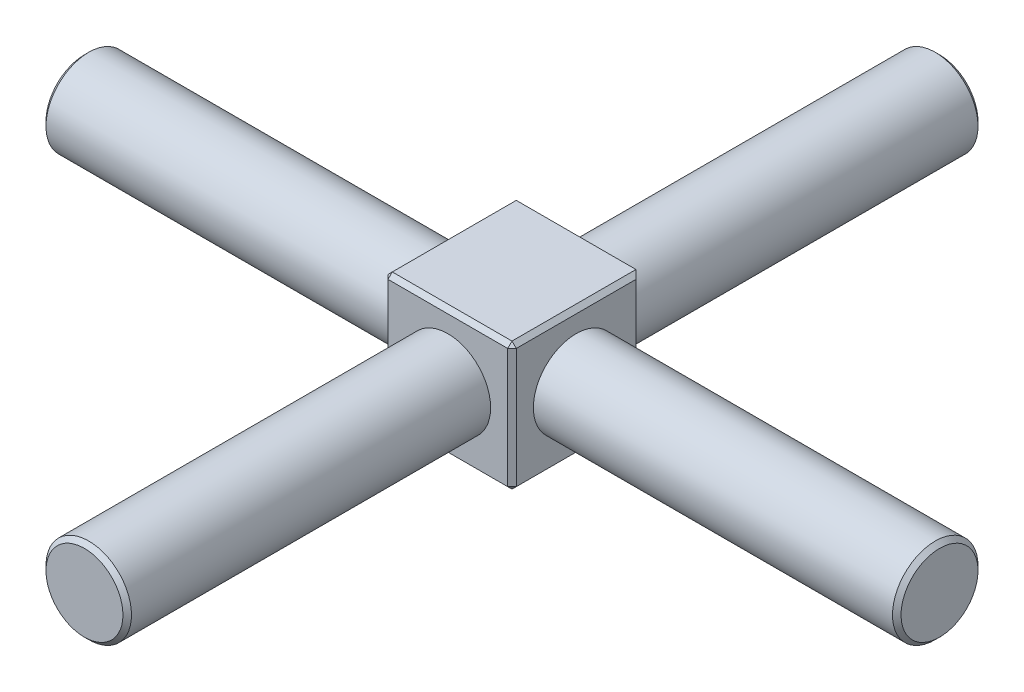
from build123d import *

# Parameters (mm, degrees)
SKETCH1_W           = 15
SKETCH1_H           = 15
BOSS_EXTRUDE1_DEPTH = 15
BOSS_EXTRUDE2_START = -7.5
SKETCH3_R           = 5
BOSS_EXTRUDE2_DEPTH = 50
BOSS_EXTRUDE3_START = -7.5
SKETCH4_R           = 5
BOSS_EXTRUDE3_DEPTH = 50
CHAMFER1_SIZE       = 0.5


with BuildPart() as part:
    # Sketch1 → Boss-Extrude1 (new body)
    with BuildSketch(Plane.XY):
        Rectangle(SKETCH1_W, SKETCH1_H)
    extrude(amount=BOSS_EXTRUDE1_DEPTH)

    # Sketch3 → Boss-Extrude2 (add, symmetric)
    with BuildSketch(Plane(origin=(7.5, 0, 0), x_dir=(0, 0, -1), z_dir=(1, 0, 0)).offset(BOSS_EXTRUDE2_START)):
        with Locations(Location((-7.5, 0, 0), (0, 0, 90))):
            Circle(SKETCH3_R)
    extrude(amount=BOSS_EXTRUDE2_DEPTH, both=True)

    # Sketch4 → Boss-Extrude3 (add, symmetric)
    with BuildSketch(Plane.XY.offset(15).offset(BOSS_EXTRUDE3_START)):
        Circle(SKETCH4_R)
    extrude(amount=BOSS_EXTRUDE3_DEPTH, both=True)

    # Chamfer1
    chamfer1_edges = [part.edges().sort_by_distance(p)[0] for p in [
        (-7.5, 0, 15),
        (-50, -5, 7.5),
        (50, -5, 7.5),
        (0, -7.5, 15),
        (-5, 0, -42.5),
        (-5, 0, 57.5),
        (7.5, 0, 15),
        (0, -7.5, 0),
        (-7.5, 0, 0),
        (7.5, 0, 0),
        (7.5, -7.5, 7.5),
        (-7.5, -7.5, 7.5),
        (-7.5, 7.5, 7.5),
        (7.5, 7.5, 7.5),
        (0, 7.5, 15),
    ]]
    chamfer(chamfer1_edges, length=CHAMFER1_SIZE)


solid = part.part
